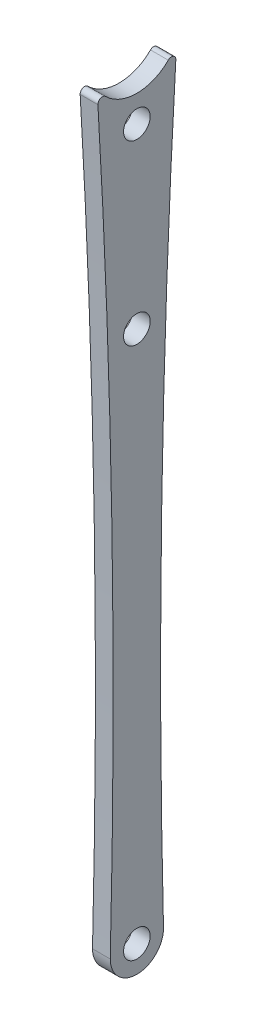
from build123d import *

# Parameters (mm, degrees)
SKETCH_1_R      = 1.5
EXTRUDE_1_DEPTH = 2


with BuildPart() as part:
    # 草图1 → 凸台-拉伸1 (new body)
    with BuildSketch(Plane(origin=(0, 0, 0), x_dir=(0, 0, -1), z_dir=(1, 0, 0))):
        with BuildLine():
            ThreePointArc((-3, 0), (0, -3), (3, 0))
            ThreePointArc((3, 0), (2.811044981, 42.056649193), (4.390645546, 84.084048678))
            ThreePointArc((4.390645546, 84.084048678), (4.096153855, 84.569530493), (3.53773065, 84.466664204))
            ThreePointArc((3.53773065, 84.466664204), (0, 83), (-3.53773065, 84.466664204))
            ThreePointArc((-3.53773065, 84.466664204), (-4.096153855, 84.569530493), (-4.390645546, 84.084048678))
            ThreePointArc((-4.390645546, 84.084048678), (-2.811044981, 42.056649193), (-3, 0))
        make_face()
        with Locations((0, 80)):
            Circle(SKETCH_1_R, mode=Mode.SUBTRACT)
        with Locations((0, 60)):
            Circle(SKETCH_1_R, mode=Mode.SUBTRACT)
        Circle(SKETCH_1_R, mode=Mode.SUBTRACT)
    extrude(amount=EXTRUDE_1_DEPTH)


solid = part.part
